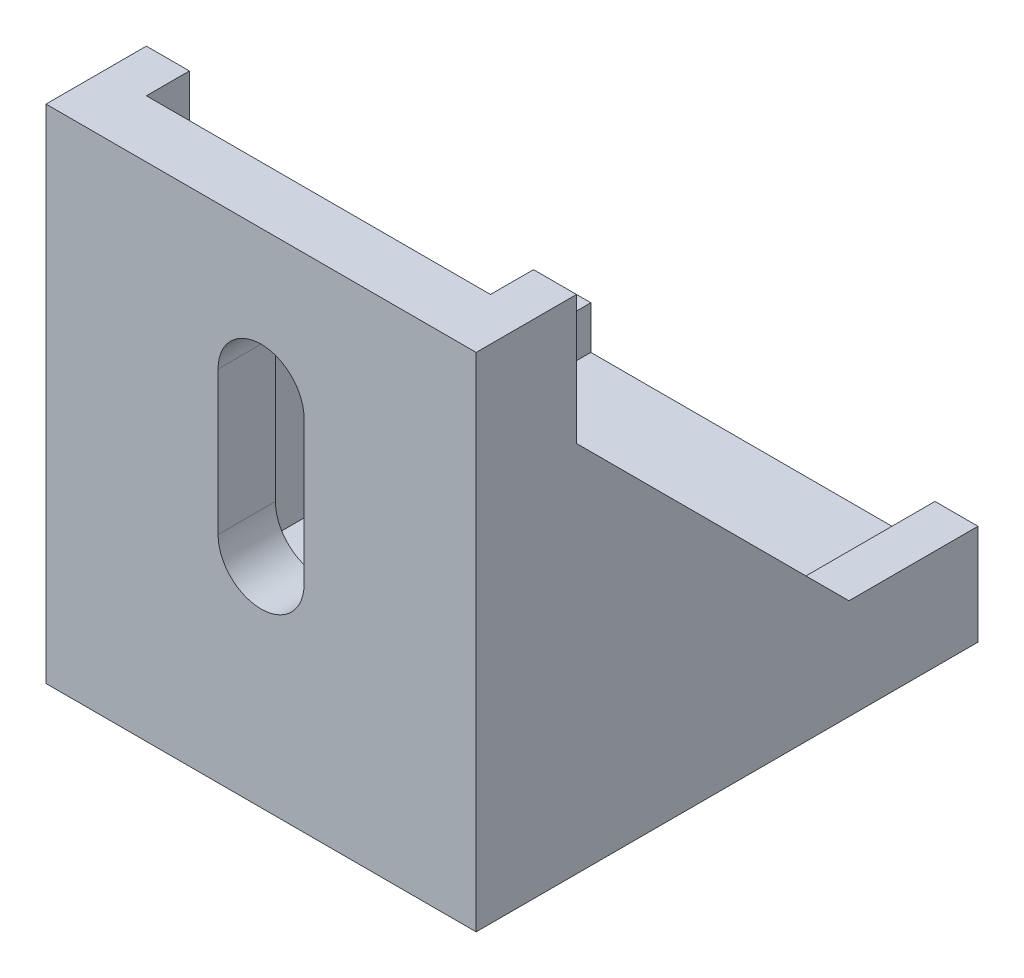
from build123d import *

# Parameters (mm, degrees)
BOSS_EXTRUDE1_DEPTH = 30
GUSSET1_THICKNESS   = 3
GUSSET2_THICKNESS   = 3
BOSS_EXTRUDE2_DEPTH = 3
BOSS_EXTRUDE3_DEPTH = 3
BOSS_EXTRUDE4_DEPTH = 3
BOSS_EXTRUDE5_DEPTH = 3
CUT_EXTRUDE1_DEPTH  = 58.879184514
CUT_EXTRUDE2_DEPTH  = 13


with BuildPart() as part:
    # Sketch2 → Boss-Extrude1 (new body)
    with BuildSketch(Plane(origin=(0, 0, 0), x_dir=(0, 0, -1), z_dir=(1, 0, 0))):
        Polygon((0, 35), (0, 0), (35, 0), (35, 4), (4, 4), (4, 35), align=None)
    extrude(amount=BOSS_EXTRUDE1_DEPTH)



with BuildPart() as body_2:
    # Gusset1: a gusset: a plate 3.0 thick in the corner of two members, its outline drawn in place
    gusset1_outline = Wire([Line((27, 4, -4), (27, 29, -4)), Line((27, 29, -4), (27, 4, -29)), Line((27, 4, -29), (27, 4, -4))])
    add(extrude(Face(gusset1_outline), amount=GUSSET1_THICKNESS, dir=(1, 0, 0)))


with BuildPart() as body_3:
    # Gusset2: a gusset: a plate 3.0 thick in the corner of two members, its outline drawn in place
    gusset2_outline = Wire([Line((3, 4, -4), (3, 4, -29)), Line((3, 4, -29), (3, 29, -4)), Line((3, 29, -4), (3, 4, -4))])
    add(extrude(Face(gusset2_outline), amount=GUSSET2_THICKNESS, dir=(-1, 0, 0)))


with BuildPart() as part_1:
    add(part.part)

    add(body_2.part)  # Boss-Extrude2 merges body 2
    # Sketch7 → Boss-Extrude2 (add)
    with BuildSketch(Plane(origin=(30, 0, 0), x_dir=(0, 0, -1), z_dir=(1, 0, 0))):
        Polygon((4, 35), (7, 35), (7, 26), (4, 29), align=None)
    extrude(amount=-BOSS_EXTRUDE2_DEPTH)


    add(body_3.part)  # Boss-Extrude3 merges body 3
    # Sketch8 → Boss-Extrude3 (add)
    with BuildSketch(Plane.ZY):
        Polygon((-4, 35), (-7, 35), (-7, 26), (-4, 29), align=None)
    extrude(amount=-BOSS_EXTRUDE3_DEPTH)

    # Sketch9 → Boss-Extrude4 (add)
    with BuildSketch(Plane.ZY):
        Polygon((-35, 4), (-35, 7), (-26, 7), (-29, 4), align=None)
    extrude(amount=-BOSS_EXTRUDE4_DEPTH)

    # Sketch10 → Boss-Extrude5 (add)
    with BuildSketch(Plane(origin=(30, 0, 0), x_dir=(0, 0, -1), z_dir=(1, 0, 0))):
        Polygon((35, 4), (35, 7), (26, 7), (29, 4), align=None)
    extrude(amount=-BOSS_EXTRUDE5_DEPTH)

    # Sketch11 → Cut-Extrude1 (cut, through all)
    with BuildSketch(Plane.XY):
        with BuildLine():
            Line((12, 15), (12, 25))
            ThreePointArc((12, 25), (15, 28), (18, 25))
            Line((18, 25), (18, 15))
            ThreePointArc((18, 15), (15, 12), (12, 15))
        make_face()
    extrude(amount=-CUT_EXTRUDE1_DEPTH, mode=Mode.SUBTRACT)

    # Sketch12 → Cut-Extrude2 (cut)
    with BuildSketch(Plane.XZ):
        with BuildLine():
            Line((12, -22.5), (12, -12.5))
            ThreePointArc((12, -12.5), (15, -9.5), (18, -12.5))
            Line((18, -12.5), (18, -22.5))
            ThreePointArc((18, -22.5), (15, -25.5), (12, -22.5))
        make_face()
    extrude(amount=-CUT_EXTRUDE2_DEPTH, mode=Mode.SUBTRACT)


solid = part_1.part
